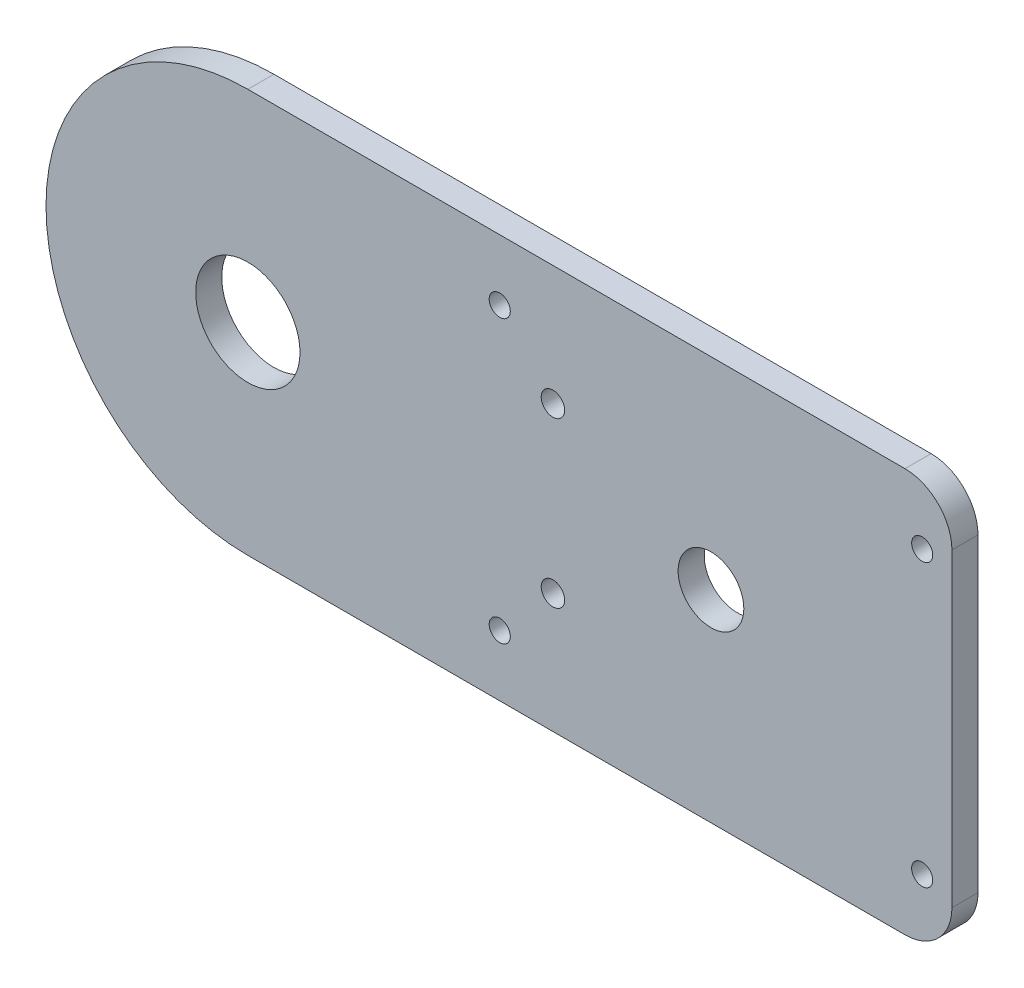
from build123d import *

# Parameters (mm, degrees)
SKETCH1_R           = 11.1125
BOSS_EXTRUDE1_DEPTH = 5.55625
SKETCH2_R           = 7.000000001
CUT_EXTRUDE1_DEPTH  = 5.55625
FILLET1_R           = 10
SKETCH3_R           = 2.250000001
CUT_EXTRUDE2_DEPTH  = 6.35
SKETCH4_R           = 2.5
CUT_EXTRUDE3_DEPTH  = 40


with BuildPart() as part:
    # Sketch1 → Boss-Extrude1 (new body)
    with BuildSketch(Plane.XY):
        with BuildLine():
            Line((-65, 43), (85, 43))
            Line((85, 43), (85, -43))
            Line((85, -43), (-65, -43))
            ThreePointArc((-65, -43), (-108, 0), (-65, 43))
        make_face()
        with Locations((-65, 0)):
            Circle(SKETCH1_R, mode=Mode.SUBTRACT)
    extrude(amount=BOSS_EXTRUDE1_DEPTH)

    # Sketch2 → Cut-Extrude1 (cut)
    with BuildSketch(Plane.XY.offset(5.55625)):
        with Locations((33.66639768, 0)):
            Circle(SKETCH2_R)
    extrude(amount=-CUT_EXTRUDE1_DEPTH, mode=Mode.SUBTRACT)

    # Fillet1
    fillet1_edges = [part.edges().sort_by_distance(p)[0] for p in [
        (85, 43, 2.778125),
        (85, -43, 2.778125),
    ]]
    fillet(fillet1_edges, radius=FILLET1_R)

    # Sketch3 → Cut-Extrude2 (cut)
    with BuildSketch(Plane.XY.offset(5.55625)):
        with Locations((78.66639768, 30)):
            Circle(SKETCH3_R)
        with Locations((78.66639768, -30)):
            Circle(SKETCH3_R)
        with Locations((-11.33360232, 30)):
            Circle(SKETCH3_R)
        with Locations((-11.33360232, -30)):
            Circle(SKETCH3_R)
    extrude(amount=-CUT_EXTRUDE2_DEPTH, mode=Mode.SUBTRACT)

    # Sketch4 → Cut-Extrude3 (cut)
    with BuildSketch(Plane.XY.offset(5.55625)):
        with Locations((0, 17.5)):
            Circle(SKETCH4_R)
        with Locations((0, -17.5)):
            Circle(SKETCH4_R)
    extrude(amount=-CUT_EXTRUDE3_DEPTH, mode=Mode.SUBTRACT)


solid = part.part
